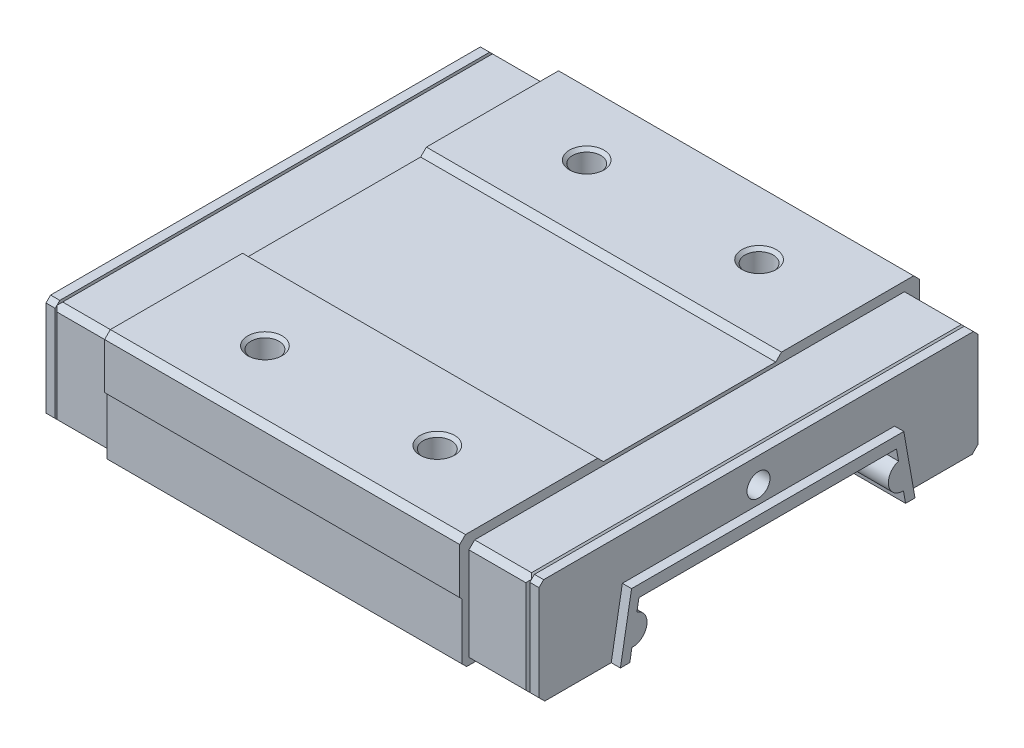
from build123d import *

# Parameters (mm, degrees)
RESSALTO_EXTRUS_O1_DEPTH      = 15.45
RESSALTO_EXTRUS_O1_DEPTH_BACK = 15.45
RESSALTO_EXTRUS_O2_DEPTH      = 6
RESSALTO_EXTRUS_O3_DEPTH      = 6
RESSALTO_EXTRUS_O4_DEPTH      = 22.25
RESSALTO_EXTRUS_O4_DEPTH_BACK = 22.25
CORTE_EXTRUS_O1_DEPTH         = 22.25
CORTE_EXTRUS_O1_DEPTH_BACK    = 22.25
ESBO_O10_W                    = 48.5
ESBO_O10_H                    = 44
CORTE_EXTRUS_O2_DEPTH         = 11
CORTE_EXTRUS_O3_DEPTH         = 20
CORTE_EXTRUS_O3_DEPTH_BACK    = 20
CORTE_EXTRUS_O4_DEPTH         = 20
CORTE_EXTRUS_O4_DEPTH_BACK    = 20
CORTE_EXTRUS_O5_DEPTH         = 10
CORTE_EXTRUS_O6_DEPTH         = 10
CORTE_EXTRUS_O7_DEPTH         = 10
CORTE_EXTRUS_O8_DEPTH         = 10
ESBO_O17_W                    = 2.5
ESBO_O17_H                    = 1
ESBO_O18_W                    = 2.5
ESBO_O18_H                    = 1


with BuildPart() as part:
    # Esboço1 → Ressalto-extrusão1 (new, two sides: drawn at the far end of the back side and taken through both)
    with BuildSketch(Plane(origin=(0, 0, 0), x_dir=(0, 0, -1), z_dir=(1, 0, 0)).offset(-RESSALTO_EXTRUS_O1_DEPTH_BACK)):
        Polygon((-20, 9.5), (-20, 5.5), (-19.8, 5.3), (-19.8, 0.4), (-19.4, 0), (19.4, 0), (19.8, 0.4), (19.8, 5.3), (20, 5.5), (20, 9.5), (19.5, 10), (8, 10), (7.5, 9.5), (-7.5, 9.5), (-8, 10), (-19.5, 10), align=None)
    extrude(amount=RESSALTO_EXTRUS_O1_DEPTH + RESSALTO_EXTRUS_O1_DEPTH_BACK)

    # Esboço2 → Ressalto-extrusão2 (add)
    with BuildSketch(Plane(origin=(-15.45, 0, 0), x_dir=(0, 0, -1), z_dir=(1, 0, 0))):
        Polygon((-19.2, 8.7), (-19.2, 0.6), (-18.6, 0), (18.6, 0), (19.2, 0.6), (19.2, 8.7), (18.7, 9.2), (-18.7, 9.2), align=None)
    extrude(amount=-RESSALTO_EXTRUS_O2_DEPTH)

    # Esboço3 → Ressalto-extrusão3 (add)
    with BuildSketch(Plane(origin=(15.45, 0, 0), x_dir=(0, 0, -1), z_dir=(1, 0, 0))):
        Polygon((-19.2, 8.7), (-19.2, 0.6), (-18.6, 0), (18.6, 0), (19.2, 0.6), (19.2, 8.7), (18.7, 9.2), (-18.7, 9.2), align=None)
    extrude(amount=RESSALTO_EXTRUS_O3_DEPTH)

    # Esboço4 → Ressalto-extrusão4 (add, two sides: drawn at the far end of the back side and taken through both)
    with BuildSketch(Plane(origin=(0, 0, 0), x_dir=(0, 0, -1), z_dir=(1, 0, 0)).offset(-RESSALTO_EXTRUS_O4_DEPTH_BACK)):
        Polygon((-12.816, 0), (12.816, 0), (11.846201606, 5.5), (-11.846201606, 5.5), align=None)
    extrude(amount=RESSALTO_EXTRUS_O4_DEPTH + RESSALTO_EXTRUS_O4_DEPTH_BACK)

    # Esboço5 → Corte-extrusão1 (cut, two sides: drawn at the far end of the back side and taken through both)
    with BuildSketch(Plane(origin=(0, 0, 0), x_dir=(0, 0, -1), z_dir=(1, 0, 0)).offset(-CORTE_EXTRUS_O1_DEPTH_BACK)):
        with BuildLine():
            Line((-12, 0), (12, 0))
            Line((12, 0), (11.814562479, 1.051668439))
            ThreePointArc((11.814562479, 1.051668439), (10.518990309, 2.082939778), (11.383714346, 3.495129625))
            Line((11.383714346, 3.495129625), (11.206528587, 4.5))
            Line((11.206528587, 4.5), (-11.206528587, 4.5))
            Line((-11.206528587, 4.5), (-11.383714346, 3.495129625))
            ThreePointArc((-11.383714346, 3.495129625), (-10.518990309, 2.082939778), (-11.814562479, 1.051668439))
            Line((-11.814562479, 1.051668439), (-12, 0))
        make_face()
    extrude(amount=CORTE_EXTRUS_O1_DEPTH + CORTE_EXTRUS_O1_DEPTH_BACK, mode=Mode.SUBTRACT)

    # Esboço6 → Corte-Revolução1 (revolve, cut)
    with BuildSketch(Plane.XY.offset(14), mode=Mode.PRIVATE) as corte_revolu_o1_sk:
        Polygon((7.5, 10), (9, 10), (8.7295, 9.7295), (8.7295, 5.8), (7.5, 5.090147844), align=None)
    revolve(corte_revolu_o1_sk.sketch.rotate(Axis((7.5, 5.090147844, 14), (0, 1, 0)), 270), axis=Axis((7.5, 5.090147844, 14), (0, 1, 0)), mode=Mode.SUBTRACT)

    # Esboço7 → Corte-Revolução2 (revolve, cut)
    with BuildSketch(Plane.XY.offset(-14), mode=Mode.PRIVATE) as corte_revolu_o2_sk:
        Polygon((-7.5, 10), (-6, 10), (-6.2705, 9.7295), (-6.2705, 5.8), (-7.5, 5.090147844), align=None)
    revolve(corte_revolu_o2_sk.sketch.rotate(Axis((-7.5, 5.090147844, -14), (0, 1, 0)), 270), axis=Axis((-7.5, 5.090147844, -14), (0, 1, 0)), mode=Mode.SUBTRACT)

    # Esboço8 → Corte-Revolução3 (revolve, cut)
    with BuildSketch(Plane.XY.offset(14), mode=Mode.PRIVATE) as corte_revolu_o3_sk:
        Polygon((-7.5, 10), (-6, 10), (-6.2705, 9.7295), (-6.2705, 5.8), (-7.5, 5.090147844), align=None)
    revolve(corte_revolu_o3_sk.sketch.rotate(Axis((-7.5, 5.090147844, 14), (0, 1, 0)), 270), axis=Axis((-7.5, 5.090147844, 14), (0, 1, 0)), mode=Mode.SUBTRACT)

    # Esboço9 → Corte-Revolução4 (revolve, cut)
    with BuildSketch(Plane.XY.offset(-14), mode=Mode.PRIVATE) as corte_revolu_o4_sk:
        Polygon((7.5, 10), (9, 10), (8.7295, 9.7295), (8.7295, 5.8), (7.5, 5.090147844), align=None)
    revolve(corte_revolu_o4_sk.sketch.rotate(Axis((7.5, 5.090147844, -14), (0, 1, 0)), 270), axis=Axis((7.5, 5.090147844, -14), (0, 1, 0)), mode=Mode.SUBTRACT)

    # Esboço10 → Corte-extrusão2 (cut)
    with BuildSketch(Plane(origin=(0, 0, 0), x_dir=(1, 0, 0), z_dir=(0, 1, 0))):
        Rectangle(ESBO_O10_W, ESBO_O10_H)
        Polygon((-23.25, 19.1), (-23.25, -19.1), (-20.65, -19.1), (-20.65, -21), (20.65, -21), (20.65, -19.1), (23.25, -19.1), (23.25, 19.1), (20.65, 19.1), (20.65, 21), (-20.65, 21), (-20.65, 19.1), align=None, mode=Mode.SUBTRACT)
    extrude(amount=CORTE_EXTRUS_O2_DEPTH, mode=Mode.SUBTRACT)

    # Esboço11 → Corte-extrusão3 (cut, two sides: drawn at the far end of the back side and taken through both)
    with BuildSketch(Plane.XY.offset(-CORTE_EXTRUS_O3_DEPTH_BACK)):
        Polygon((-20.65, 9.2), (-20.65, 8.95), (-20.4, 9.2), align=None)
    extrude(amount=CORTE_EXTRUS_O3_DEPTH + CORTE_EXTRUS_O3_DEPTH_BACK, mode=Mode.SUBTRACT)

    # Esboço12 → Corte-extrusão4 (cut, two sides: drawn at the far end of the back side and taken through both)
    with BuildSketch(Plane.XY.offset(-CORTE_EXTRUS_O4_DEPTH_BACK)):
        Polygon((20.4, 9.2), (20.65, 8.95), (20.65, 9.2), align=None)
    extrude(amount=CORTE_EXTRUS_O4_DEPTH + CORTE_EXTRUS_O4_DEPTH_BACK, mode=Mode.SUBTRACT)

    # Esboço13 → Corte-extrusão5 (cut)
    with BuildSketch(Plane(origin=(0, 0, 0), x_dir=(1, 0, 0), z_dir=(0, 1, 0))):
        Polygon((-20.65, 19.2), (-20.65, 18.95), (-20.4, 19.2), align=None)
    extrude(amount=CORTE_EXTRUS_O5_DEPTH, mode=Mode.SUBTRACT)

    # Esboço14 → Corte-extrusão6 (cut)
    with BuildSketch(Plane(origin=(0, 0, 0), x_dir=(1, 0, 0), z_dir=(0, 1, 0))):
        Polygon((-20.65, -19.2), (-20.4, -19.2), (-20.65, -18.95), align=None)
    extrude(amount=CORTE_EXTRUS_O6_DEPTH, mode=Mode.SUBTRACT)

    # Esboço15 → Corte-extrusão7 (cut)
    with BuildSketch(Plane(origin=(0, 0, 0), x_dir=(1, 0, 0), z_dir=(0, 1, 0))):
        Polygon((20.4, 19.2), (20.65, 18.95), (20.65, 19.2), align=None)
    extrude(amount=CORTE_EXTRUS_O7_DEPTH, mode=Mode.SUBTRACT)

    # Esboço16 → Corte-extrusão8 (cut)
    with BuildSketch(Plane(origin=(0, 0, 0), x_dir=(1, 0, 0), z_dir=(0, 1, 0))):
        Polygon((20.4, -19.2), (20.65, -19.2), (20.65, -18.95), align=None)
    extrude(amount=CORTE_EXTRUS_O8_DEPTH, mode=Mode.SUBTRACT)

    # Esboço17 → Corte-Revolução5 (revolve, cut)
    with BuildSketch(Plane.XY, mode=Mode.PRIVATE) as corte_revolu_o5_sk:
        with Locations((-20.2, 7.5)):
            Rectangle(ESBO_O17_W, ESBO_O17_H)
    revolve(corte_revolu_o5_sk.sketch.rotate(Axis((-18.95, 7, 0), (-1, 0, 0)), 270), axis=Axis((-18.95, 7, 0), (-1, 0, 0)), mode=Mode.SUBTRACT)

    # Esboço18 → Corte-Revolução6 (revolve, cut)
    with BuildSketch(Plane.XY, mode=Mode.PRIVATE) as corte_revolu_o6_sk:
        with Locations((20.2, 7.5)):
            Rectangle(ESBO_O18_W, ESBO_O18_H)
    revolve(corte_revolu_o6_sk.sketch.rotate(Axis((21.45, 7, 0), (-1, 0, 0)), 270), axis=Axis((21.45, 7, 0), (-1, 0, 0)), mode=Mode.SUBTRACT)


solid = part.part
